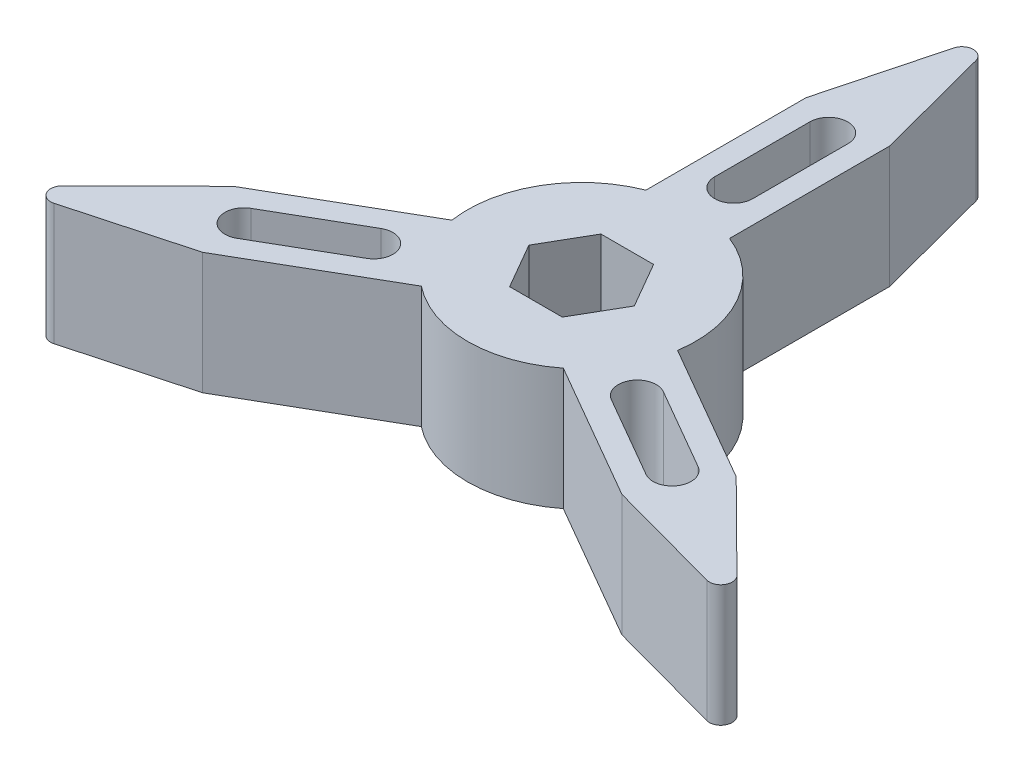
from build123d import *

# Parameters (mm, degrees)
SKETCH1_R           = 30
BOSS_EXTRUDE1_DEPTH = 32


with BuildPart() as part:
    # Sketch1 → Boss-Extrude1 (new body)
    # profile 1 of 4: a face of its own
    with BuildSketch(Plane(origin=(0, 0, 0), x_dir=(1, 0, 0), z_dir=(0, 1, 0))):
        with BuildLine():
            Line((11, 27.910571474), (11, 70))
            Line((11, 70), (2.901151097, 100.763755402))
            ThreePointArc((2.901151097, 100.763755402), (0, 103), (-2.901151097, 100.763755402))
            Line((-2.901151097, 100.763755402), (-11, 70))
            Line((-11, 70), (-11, 27.910571474))
            ThreePointArc((-11, 27.910571474), (0, 30), (11, 27.910571474))
        make_face()
        with BuildLine():
            ThreePointArc((5, 40), (0, 35), (-5, 40))
            Line((-5, 40), (-5, 65))
            ThreePointArc((-5, 65), (0, 70), (5, 65))
            Line((5, 65), (5, 40))
        make_face(mode=Mode.SUBTRACT)
    # profile 2 of 4: a face of its own
    with BuildSketch(Plane(origin=(0, 0, 0), x_dir=(1, 0, 0), z_dir=(0, 1, 0))):
        Circle(SKETCH1_R)
        Polygon((6.92820323, -12), (13.856406461, 0), (6.92820323, 12), (-6.92820323, 12), (-13.856406461, 0), (-6.92820323, -12), align=None, mode=Mode.SUBTRACT)
    # profile 3 of 4: a face of its own
    with BuildSketch(Plane(origin=(0, 0, 0), x_dir=(1, 0, 0), z_dir=(0, 1, 0))):
        with BuildLine():
            Line((66.121778265, -25.473720558), (29.671263931, -4.429006295))
            ThreePointArc((29.671263931, -4.429006295), (25.980762114, -15), (18.671263931, -23.481565179))
            Line((18.671263931, -23.481565179), (55.121778265, -44.526279442))
            Line((55.121778265, -44.526279442), (85.813396411, -52.894348251))
            ThreePointArc((85.813396411, -52.894348251), (89.20061659, -51.5), (88.714547507, -47.869407151))
            Line((88.714547507, -47.869407151), (66.121778265, -25.473720558))
        make_face()
        with BuildLine():
            ThreePointArc((32.141016151, -24.330127019), (30.310889132, -17.5), (37.141016151, -15.669872981))
            Line((37.141016151, -15.669872981), (58.791651246, -28.169872981))
            ThreePointArc((58.791651246, -28.169872981), (60.621778265, -35), (53.791651246, -36.830127019))
            Line((53.791651246, -36.830127019), (32.141016151, -24.330127019))
        make_face(mode=Mode.SUBTRACT)
    # profile 4 of 4: a face of its own
    with BuildSketch(Plane(origin=(0, 0, 0), x_dir=(1, 0, 0), z_dir=(0, 1, 0))):
        with BuildLine():
            ThreePointArc((-18.671263931, -23.481565179), (-25.980762114, -15), (-29.671263931, -4.429006295))
            Line((-29.671263931, -4.429006295), (-66.121778265, -25.473720558))
            Line((-66.121778265, -25.473720558), (-88.714547507, -47.869407151))
            ThreePointArc((-88.714547507, -47.869407151), (-89.20061659, -51.5), (-85.813396411, -52.894348251))
            Line((-85.813396411, -52.894348251), (-55.121778265, -44.526279442))
            Line((-55.121778265, -44.526279442), (-18.671263931, -23.481565179))
        make_face()
        with BuildLine():
            ThreePointArc((-37.141016151, -15.669872981), (-30.310889132, -17.5), (-32.141016151, -24.330127019))
            Line((-32.141016151, -24.330127019), (-53.791651246, -36.830127019))
            ThreePointArc((-53.791651246, -36.830127019), (-60.621778265, -35), (-58.791651246, -28.169872981))
            Line((-58.791651246, -28.169872981), (-37.141016151, -15.669872981))
        make_face(mode=Mode.SUBTRACT)
    extrude(amount=BOSS_EXTRUDE1_DEPTH)


solid = part.part
